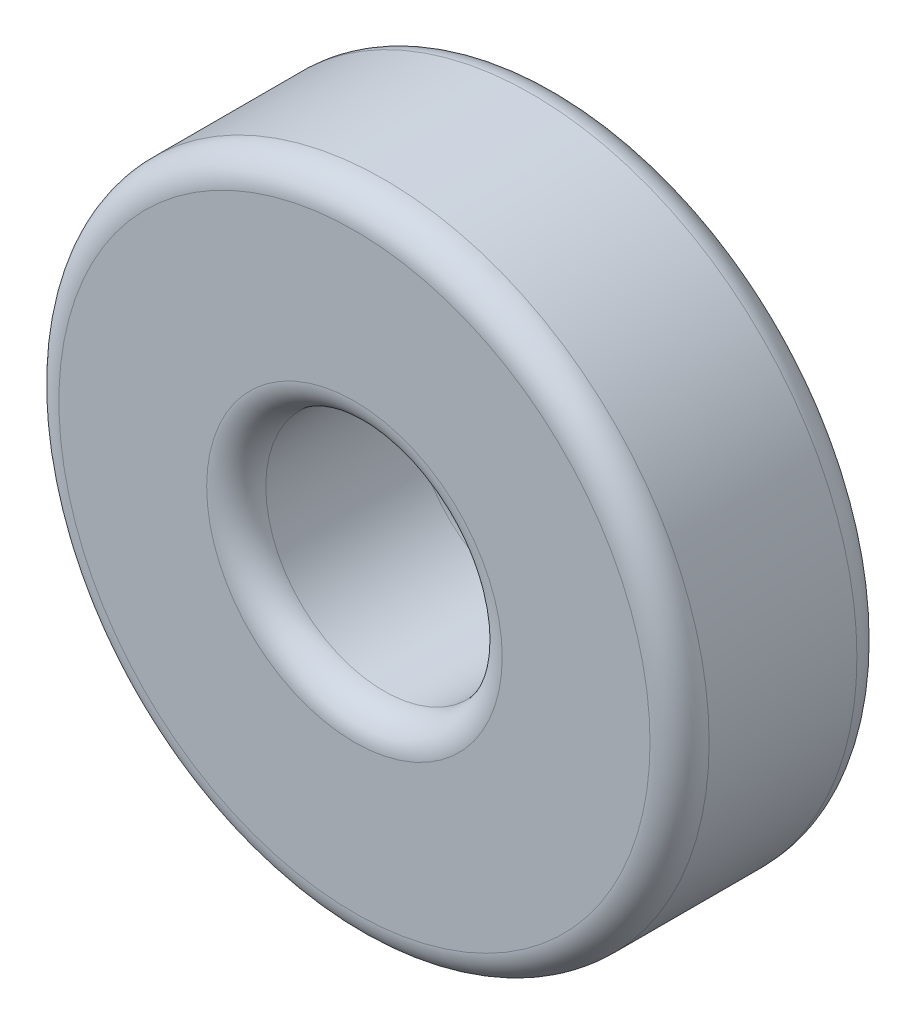
from build123d import *

# Parameters (mm, degrees)
SKETCH1_R           = 11
SKETCH1_R_2         = 4
BOSS_EXTRUDE1_DEPTH = 3.5
FILLET4_R           = 1


with BuildPart() as part:
    # Sketch1 → Boss-Extrude1 (new, symmetric)
    with BuildSketch(Plane.XY):
        Circle(SKETCH1_R)
        Circle(SKETCH1_R_2, mode=Mode.SUBTRACT)
    extrude(amount=BOSS_EXTRUDE1_DEPTH, both=True)

    # Fillet4
    fillet4_edges = [part.edges().sort_by_distance(p)[0] for p in [
        (-11, 0, -3.5),
        (-11, 0, 3.5),
        (-4, 0, -3.5),
        (-4, 0, 3.5),
    ]]
    fillet(fillet4_edges, radius=FILLET4_R)


solid = part.part
